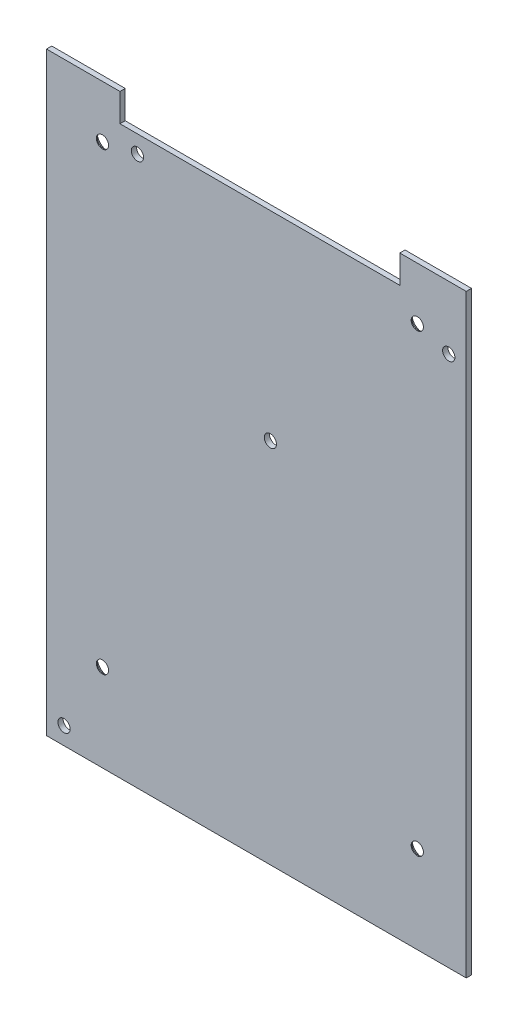
from build123d import *

# Parameters (mm, degrees)
SKETCH_1_W          = 135
SKETCH_1_H          = 73
SKETCH_1_R          = 1.75
EXTRUDE_1_DEPTH     = 1.5
EXTRUDE_2_DEPTH     = 1.5
SKETCH_3_R          = 1.75
CUT_EXTRUDE_1_DEPTH = 10
SKETCH_4_W          = 41.774979177
SKETCH_4_H          = 174.552922684
SKETCH_4_W_2        = 25.198535703
SKETCH_4_H_2        = 178.613265212
SKETCH_4_W_3        = 80
SKETCH_4_H_3        = 12.9239929
CUT_EXTRUDE_2_DEPTH = 10
SKETCH_5_W          = 120
SKETCH_5_H          = 1.5
EXTRUDE_3_DEPTH     = 20
SKETCH_6_R          = 1.75
CUT_EXTRUDE_3_DEPTH = 20
CHAMFER_1_SIZE      = 1.25


with BuildPart() as part:
    # Эскиз1 → Вытянуть1 (new body)
    with BuildSketch(Plane.XY):
        with Locations((67.5, 36.5)):
            Rectangle(SKETCH_1_W, SKETCH_1_H)
        with Locations((118, 55)):
            Circle(SKETCH_1_R, mode=Mode.SUBTRACT)
        with Locations((29, 60)):
            Circle(SKETCH_1_R, mode=Mode.SUBTRACT)
        with Locations((67, 8)):
            Circle(SKETCH_1_R, mode=Mode.SUBTRACT)
    extrude(amount=EXTRUDE_1_DEPTH)

    # Эскиз2 → Вытянуть2 (add)
    with BuildSketch(Plane(origin=(0, 0, 0), x_dir=(-1, 0, 0), z_dir=(0, 0, -1))):
        Polygon((-135, 0), (-135, 73), (-137.5, 73), (-137.5, -77), (12.5, -77), (12.5, 73), (0, 73), (0, 0), align=None)
    extrude(amount=-EXTRUDE_2_DEPTH)

    # Эскиз3 → Вырез-Вытянуть1 (cut)
    with BuildSketch(Plane(origin=(0, 0, 0), x_dir=(-1, 0, 0), z_dir=(0, 0, -1))):
        with Locations((-109, 58)):
            Circle(SKETCH_3_R)
        with Locations((-109, -72)):
            Circle(SKETCH_3_R)
        with Locations((-19, -72)):
            Circle(SKETCH_3_R)
        with Locations((-19, 58)):
            Circle(SKETCH_3_R)
    extrude(amount=-CUT_EXTRUDE_1_DEPTH, mode=Mode.SUBTRACT)

    # Эскиз4 → Вырез-Вытянуть2 (cut)
    with BuildSketch(Plane(origin=(0, 0, 0), x_dir=(-1, 0, 0), z_dir=(0, 0, -1))):
        with Locations((17.887489589, -5.455920086)):
            Rectangle(SKETCH_4_W, SKETCH_4_H)
        with Locations((-135.599267852, -7.48609135)):
            Rectangle(SKETCH_4_W_2, SKETCH_4_H_2)
        with Locations((-64, 71.46199645)):
            Rectangle(SKETCH_4_W_3, SKETCH_4_H_3)
    extrude(amount=-CUT_EXTRUDE_2_DEPTH, mode=Mode.SUBTRACT)

    # Эскиз5 → Вытянуть3 (add)
    with BuildSketch(Plane.XZ.offset(77)):
        with Locations((63, 0.75)):
            Rectangle(SKETCH_5_W, SKETCH_5_H)
    extrude(amount=EXTRUDE_3_DEPTH)

    # Эскиз6 → Вырез-Вытянуть3 (cut)
    with BuildSketch(Plane(origin=(0, 0, 0), x_dir=(-1, 0, 0), z_dir=(0, 0, -1))):
        with Locations((-8, -92)):
            Circle(SKETCH_6_R)
    extrude(amount=-CUT_EXTRUDE_3_DEPTH, mode=Mode.SUBTRACT)

    # Фаска1
    chamfer_1_edges = [part.edges().sort_by_distance(p)[0] for p in [
        (110.75, 58, 0),
        (110.75, -72, 0),
        (20.75, -72, 0),
        (20.75, 58, 0),
    ]]
    chamfer(chamfer_1_edges, length=CHAMFER_1_SIZE)


solid = part.part
